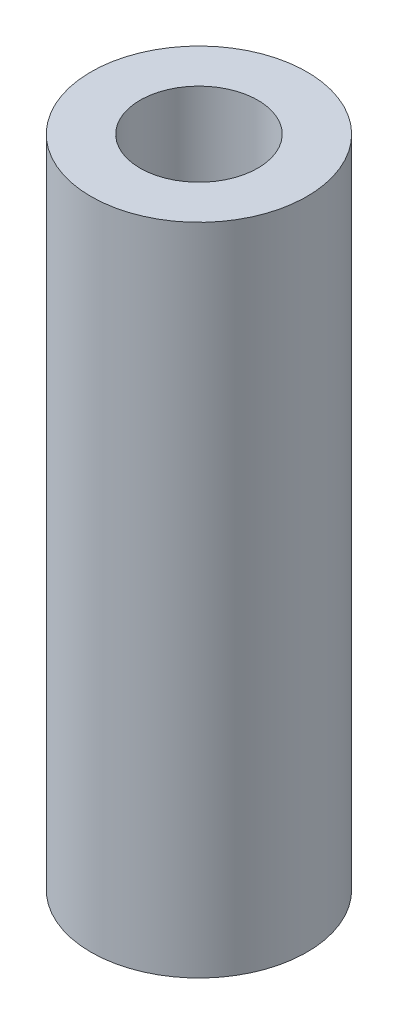
from build123d import *

# Parameters (mm, degrees)
SKETCH1_R           = 3.3
SKETCH1_R_2         = 1.8
BOSS_EXTRUDE1_DEPTH = 20


with BuildPart() as part:
    # Sketch1 → Boss-Extrude1 (new body)
    with BuildSketch(Plane(origin=(0, 0, 0), x_dir=(1, 0, 0), z_dir=(0, 1, 0))):
        with Locations(Location((0, 0, 0), (0, 0, 270))):
            Circle(SKETCH1_R)
        with Locations(Location((0, 0, 0), (0, 0, 270))):
            Circle(SKETCH1_R_2, mode=Mode.SUBTRACT)
    extrude(amount=BOSS_EXTRUDE1_DEPTH)


solid = part.part
